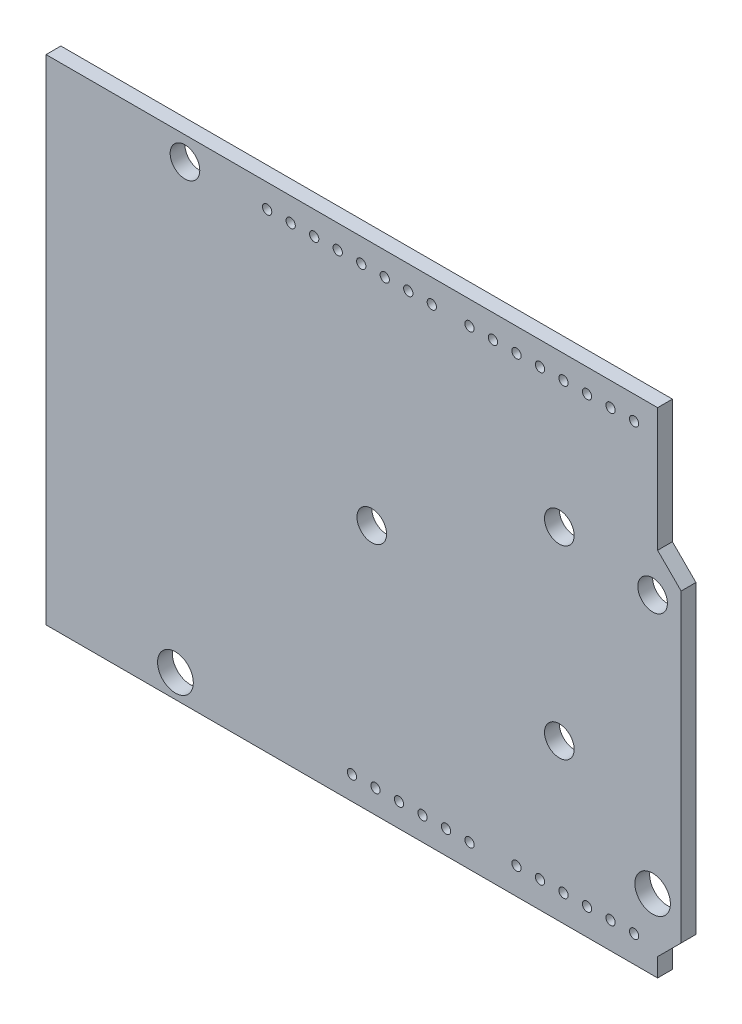
from build123d import *

# Parameters (mm, degrees)
SKETCH_1_R          = 0.5
SKETCH_1_R_2        = 1.6
SKETCH_1_R_3        = 1.931745927
SKETCH_1_R_4        = 1.598107179
SKETCH_1_R_5        = 1.917728615
EXTRUDE_1_DEPTH     = 1.6
SKETCH_2_R          = 1.6
CUT_EXTRUDE_1_DEPTH = 87.896098877


with BuildPart() as part:
    # 草图1 → 凸台-拉伸1 (new body)
    with BuildSketch(Plane.XY):
        Polygon((0, 0), (66.04, 0), (66.04, -13.34), (68.58, -15.88), (68.58, -48.8), (66.04, -51.34), (66.04, -53.34), (0, -53.34), align=None)
        with Locations((45.731390723, -50.8)):
            Circle(SKETCH_1_R, mode=Mode.SUBTRACT)
        with Locations((63.5, -50.46)):
            Circle(SKETCH_1_R, mode=Mode.SUBTRACT)
        with Locations((43.191390723, -50.8)):
            Circle(SKETCH_1_R, mode=Mode.SUBTRACT)
        with Locations((40.651390723, -50.8)):
            Circle(SKETCH_1_R, mode=Mode.SUBTRACT)
        with Locations((38.111390723, -50.8)):
            Circle(SKETCH_1_R, mode=Mode.SUBTRACT)
        with Locations((35.571390723, -50.8)):
            Circle(SKETCH_1_R, mode=Mode.SUBTRACT)
        with Locations((33.031390723, -50.8)):
            Circle(SKETCH_1_R, mode=Mode.SUBTRACT)
        with Locations((60.96, -50.46)):
            Circle(SKETCH_1_R, mode=Mode.SUBTRACT)
        with Locations((58.42, -50.46)):
            Circle(SKETCH_1_R, mode=Mode.SUBTRACT)
        with Locations((55.88, -50.46)):
            Circle(SKETCH_1_R, mode=Mode.SUBTRACT)
        with Locations((53.34, -50.46)):
            Circle(SKETCH_1_R, mode=Mode.SUBTRACT)
        with Locations((50.8, -50.46)):
            Circle(SKETCH_1_R, mode=Mode.SUBTRACT)
        with Locations((15, -2.54)):
            Circle(SKETCH_1_R_2, mode=Mode.SUBTRACT)
        with Locations((41.656, -2.54)):
            Circle(SKETCH_1_R, mode=Mode.SUBTRACT)
        with Locations((63.5, -2.54)):
            Circle(SKETCH_1_R, mode=Mode.SUBTRACT)
        with Locations((39.116, -2.54)):
            Circle(SKETCH_1_R, mode=Mode.SUBTRACT)
        with Locations((36.576, -2.54)):
            Circle(SKETCH_1_R, mode=Mode.SUBTRACT)
        with Locations((34.036, -2.54)):
            Circle(SKETCH_1_R, mode=Mode.SUBTRACT)
        with Locations((31.496, -2.54)):
            Circle(SKETCH_1_R, mode=Mode.SUBTRACT)
        with Locations((28.956, -2.54)):
            Circle(SKETCH_1_R, mode=Mode.SUBTRACT)
        with Locations((26.416, -2.54)):
            Circle(SKETCH_1_R, mode=Mode.SUBTRACT)
        with Locations((23.876, -2.54)):
            Circle(SKETCH_1_R, mode=Mode.SUBTRACT)
        with Locations((60.96, -2.54)):
            Circle(SKETCH_1_R, mode=Mode.SUBTRACT)
        with Locations((58.42, -2.54)):
            Circle(SKETCH_1_R, mode=Mode.SUBTRACT)
        with Locations((55.88, -2.54)):
            Circle(SKETCH_1_R, mode=Mode.SUBTRACT)
        with Locations((53.34, -2.54)):
            Circle(SKETCH_1_R, mode=Mode.SUBTRACT)
        with Locations((50.8, -2.54)):
            Circle(SKETCH_1_R, mode=Mode.SUBTRACT)
        with Locations((48.26, -2.54)):
            Circle(SKETCH_1_R, mode=Mode.SUBTRACT)
        with Locations((45.72, -2.54)):
            Circle(SKETCH_1_R, mode=Mode.SUBTRACT)
        with Locations((13.97, -50.8)):
            Circle(SKETCH_1_R_3, mode=Mode.SUBTRACT)
        with Locations((65.5, -17.78)):
            Circle(SKETCH_1_R_4, mode=Mode.SUBTRACT)
        with Locations((65.5, -45.72)):
            Circle(SKETCH_1_R_5, mode=Mode.SUBTRACT)
    extrude(amount=EXTRUDE_1_DEPTH)

    # 草图2 → 切除-拉伸1 (cut, through all)
    with BuildSketch(Plane.XY.offset(1.6)):
        with Locations((55.428544368, -16.466121162)):
            Circle(SKETCH_2_R)
        with Locations((35.172593904, -26.466121162)):
            Circle(SKETCH_2_R)
        with Locations((55.428544368, -36.466121162)):
            Circle(SKETCH_2_R)
    extrude(amount=-CUT_EXTRUDE_1_DEPTH, mode=Mode.SUBTRACT)


solid = part.part
